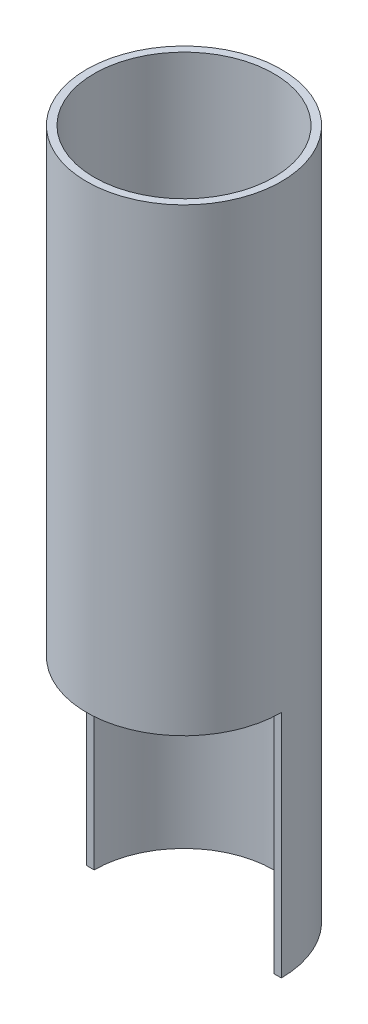
from build123d import *

# Parameters (mm, degrees)
SKETCH1_R           = 25.4
BOSS_EXTRUDE1_DEPTH = 180
SKETCH2_R           = 23.45
CUT_EXTRUDE1_DEPTH  = 180
SKETCH4_W           = 79.8
SKETCH4_H           = 60
CUT_EXTRUDE2_DEPTH  = 50


with BuildPart() as part:
    # Sketch1 → Boss-Extrude1 (new body)
    with BuildSketch(Plane(origin=(0, 0, 0), x_dir=(1, 0, 0), z_dir=(0, 1, 0))):
        with Locations(Location((0, 0, 0), (0, 0, 180))):
            Circle(SKETCH1_R)
    extrude(amount=BOSS_EXTRUDE1_DEPTH)

    # Sketch2 → Cut-Extrude1 (cut)
    with BuildSketch(Plane(origin=(0, 180, 0), x_dir=(1, 0, 0), z_dir=(0, 1, 0))):
        with Locations(Location((0, 0, 0), (0, 0, 270))):
            Circle(SKETCH2_R)
    extrude(amount=-CUT_EXTRUDE1_DEPTH, mode=Mode.SUBTRACT)

    # Sketch4 → Cut-Extrude2 (cut)
    with BuildSketch(Plane.XY.offset(50)):
        with Locations((0, 30)):
            Rectangle(SKETCH4_W, SKETCH4_H)
    extrude(amount=-CUT_EXTRUDE2_DEPTH, mode=Mode.SUBTRACT)


solid = part.part
